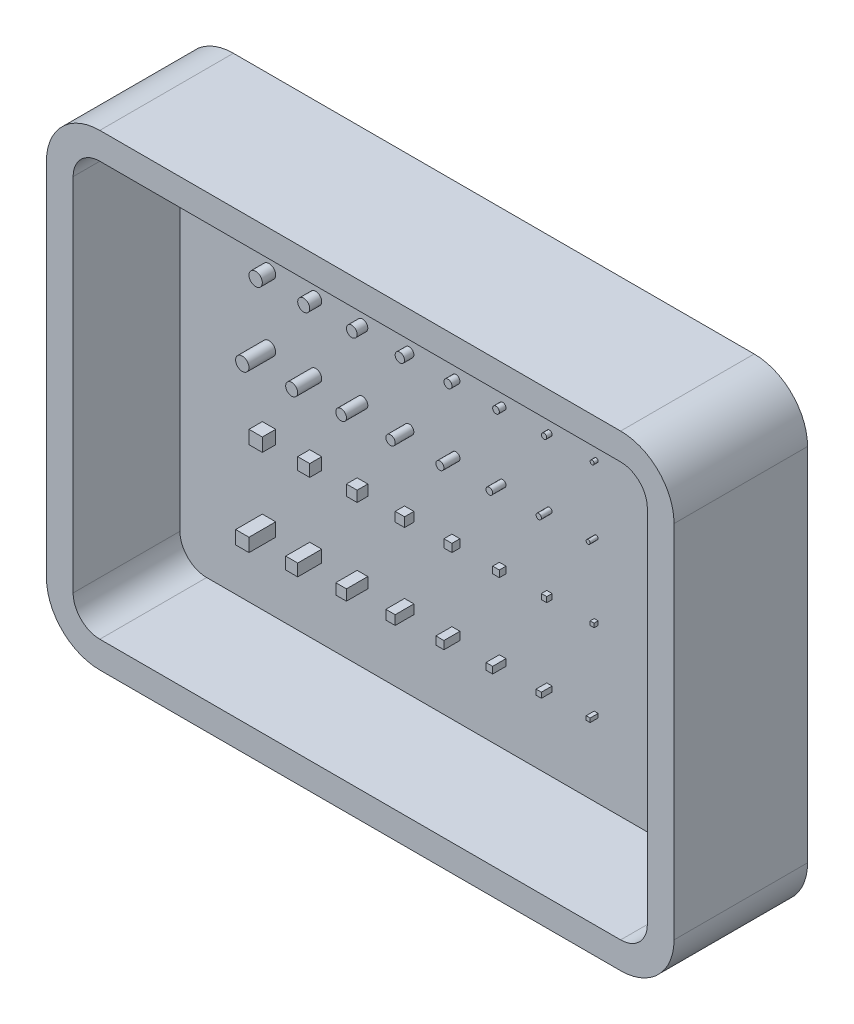
from build123d import *

# Parameters (mm, degrees)
SKETCH1_W            = 47
SKETCH1_H            = 35
BOSS_EXTRUDE1_DEPTH  = 10
FILLET1_R            = 4
SHELL1_T             = -2
SKETCH2_R            = 0.5
BOSS_EXTRUDE6_DEPTH  = 1
SKETCH3_R            = 0.45
BOSS_EXTRUDE7_DEPTH  = 0.9
SKETCH4_R            = 0.4
BOSS_EXTRUDE8_DEPTH  = 0.8
SKETCH5_R            = 0.35
BOSS_EXTRUDE9_DEPTH  = 0.7
SKETCH6_R            = 0.3
BOSS_EXTRUDE10_DEPTH = 0.6
SKETCH7_R            = 0.25
BOSS_EXTRUDE11_DEPTH = 0.5
SKETCH8_R            = 0.2
BOSS_EXTRUDE12_DEPTH = 0.4
SKETCH9_R            = 0.15
BOSS_EXTRUDE13_DEPTH = 0.3
SKETCH10_R           = 0.5
BOSS_EXTRUDE14_DEPTH = 2
SKETCH11_R           = 0.45
BOSS_EXTRUDE15_DEPTH = 1.8
SKETCH12_R           = 0.4
BOSS_EXTRUDE16_DEPTH = 1.6
SKETCH13_R           = 0.35
BOSS_EXTRUDE17_DEPTH = 1.4
SKETCH14_R           = 0.3
BOSS_EXTRUDE18_DEPTH = 1.2
SKETCH15_R           = 0.25
BOSS_EXTRUDE19_DEPTH = 1
SKETCH16_R           = 0.2
BOSS_EXTRUDE20_DEPTH = 0.8
SKETCH17_R           = 0.15
BOSS_EXTRUDE21_DEPTH = 0.6
SKETCH18_W           = 1
SKETCH18_H           = 1
BOSS_EXTRUDE22_DEPTH = 1
SKETCH20_W           = 0.9
SKETCH20_H           = 0.9
BOSS_EXTRUDE23_DEPTH = 0.9
SKETCH21_W           = 0.8
SKETCH21_H           = 0.8
BOSS_EXTRUDE24_DEPTH = 0.8
SKETCH22_W           = 0.7
SKETCH22_H           = 0.7
BOSS_EXTRUDE25_DEPTH = 0.7
SKETCH23_W           = 0.6
SKETCH23_H           = 0.6
BOSS_EXTRUDE26_DEPTH = 0.6
SKETCH24_W           = 0.5
SKETCH24_H           = 0.5
BOSS_EXTRUDE27_DEPTH = 0.5
SKETCH25_W           = 0.4
SKETCH25_H           = 0.4
BOSS_EXTRUDE28_DEPTH = 0.4
SKETCH26_W           = 0.3
SKETCH26_H           = 0.3
BOSS_EXTRUDE29_DEPTH = 0.3
SKETCH27_W           = 1
SKETCH27_H           = 1
BOSS_EXTRUDE30_DEPTH = 2
SKETCH28_W           = 0.9
SKETCH28_H           = 0.9
BOSS_EXTRUDE31_DEPTH = 1.8
SKETCH29_W           = 0.8
SKETCH29_H           = 0.8
BOSS_EXTRUDE32_DEPTH = 1.6
SKETCH30_W           = 0.7
SKETCH30_H           = 0.7
BOSS_EXTRUDE33_DEPTH = 1.4
SKETCH31_W           = 0.6
SKETCH31_H           = 0.6
BOSS_EXTRUDE34_DEPTH = 1.2
SKETCH32_W           = 0.5
SKETCH32_H           = 0.5
BOSS_EXTRUDE35_DEPTH = 1
SKETCH33_W           = 0.4
SKETCH33_H           = 0.4
BOSS_EXTRUDE36_DEPTH = 0.8
SKETCH34_W           = 0.3
SKETCH34_H           = 0.3
BOSS_EXTRUDE37_DEPTH = 0.6


with BuildPart() as part:
    # Sketch1 → Boss-Extrude1 (new body)
    with BuildSketch(Plane.XY):
        with Locations((2.008287293, -0.759668508)):
            Rectangle(SKETCH1_W, SKETCH1_H)
    extrude(amount=BOSS_EXTRUDE1_DEPTH)

    # Fillet1
    fillet1_edges = [part.edges().sort_by_distance(p)[0] for p in [
        (25.508287293, 16.740331492, 5),
        (25.508287293, -18.259668508, 5),
        (-21.491712707, -18.259668508, 5),
        (-21.491712707, 16.740331492, 5),
    ]]
    fillet(fillet1_edges, radius=FILLET1_R)

    # Shell1
    shell1_openings = [part.faces().sort_by_distance(p)[0] for p in [
        (2.008287293, -0.759668508, 10),
    ]]
    offset(amount=SHELL1_T, openings=shell1_openings, kind=Kind.INTERSECTION)

    # Sketch2 → Boss-Extrude6 (add)
    with BuildSketch(Plane.XY.offset(2)):
        with Locations((-12.824656071, 5.939639856)):
            Circle(SKETCH2_R)
    extrude(amount=BOSS_EXTRUDE6_DEPTH)

    # Sketch3 → Boss-Extrude7 (add)
    with BuildSketch(Plane.XY.offset(2)):
        with Locations((-9.324656071, 5.939639856)):
            Circle(SKETCH3_R)
    extrude(amount=BOSS_EXTRUDE7_DEPTH)

    # Sketch4 → Boss-Extrude8 (add)
    with BuildSketch(Plane.XY.offset(2)):
        with Locations((-5.824656071, 5.939639856)):
            Circle(SKETCH4_R)
    extrude(amount=BOSS_EXTRUDE8_DEPTH)

    # Sketch5 → Boss-Extrude9 (add)
    with BuildSketch(Plane.XY.offset(2)):
        with Locations((-2.324656071, 5.939639856)):
            Circle(SKETCH5_R)
    extrude(amount=BOSS_EXTRUDE9_DEPTH)

    # Sketch6 → Boss-Extrude10 (add)
    with BuildSketch(Plane.XY.offset(2)):
        with Locations((1.175343929, 5.939639856)):
            Circle(SKETCH6_R)
    extrude(amount=BOSS_EXTRUDE10_DEPTH)

    # Sketch7 → Boss-Extrude11 (add)
    with BuildSketch(Plane.XY.offset(2)):
        with Locations((4.675343929, 5.939639856)):
            Circle(SKETCH7_R)
    extrude(amount=BOSS_EXTRUDE11_DEPTH)

    # Sketch8 → Boss-Extrude12 (add)
    with BuildSketch(Plane.XY.offset(2)):
        with Locations((8.175343929, 5.939639856)):
            Circle(SKETCH8_R)
    extrude(amount=BOSS_EXTRUDE12_DEPTH)

    # Sketch9 → Boss-Extrude13 (add)
    with BuildSketch(Plane.XY.offset(2)):
        with Locations((11.675343929, 5.939639856)):
            Circle(SKETCH9_R)
    extrude(amount=BOSS_EXTRUDE13_DEPTH)

    # Sketch10 → Boss-Extrude14 (add)
    with BuildSketch(Plane.XY.offset(2)):
        with Locations((-12.824656071, 0.939639856)):
            Circle(SKETCH10_R)
    extrude(amount=BOSS_EXTRUDE14_DEPTH)

    # Sketch11 → Boss-Extrude15 (add)
    with BuildSketch(Plane.XY.offset(2)):
        with Locations((-9.324656071, 0.931713012)):
            Circle(SKETCH11_R)
    extrude(amount=BOSS_EXTRUDE15_DEPTH)

    # Sketch12 → Boss-Extrude16 (add)
    with BuildSketch(Plane.XY.offset(2)):
        with Locations((-5.824656071, 0.931713012)):
            Circle(SKETCH12_R)
    extrude(amount=BOSS_EXTRUDE16_DEPTH)

    # Sketch13 → Boss-Extrude17 (add)
    with BuildSketch(Plane.XY.offset(2)):
        with Locations((-2.324656071, 0.931713012)):
            Circle(SKETCH13_R)
    extrude(amount=BOSS_EXTRUDE17_DEPTH)

    # Sketch14 → Boss-Extrude18 (add)
    with BuildSketch(Plane.XY.offset(2)):
        with Locations((1.175343929, 0.931713012)):
            Circle(SKETCH14_R)
    extrude(amount=BOSS_EXTRUDE18_DEPTH)

    # Sketch15 → Boss-Extrude19 (add)
    with BuildSketch(Plane.XY.offset(2)):
        with Locations((4.675343929, 0.931713012)):
            Circle(SKETCH15_R)
    extrude(amount=BOSS_EXTRUDE19_DEPTH)

    # Sketch16 → Boss-Extrude20 (add)
    with BuildSketch(Plane.XY.offset(2)):
        with Locations((8.175343929, 0.931713012)):
            Circle(SKETCH16_R)
    extrude(amount=BOSS_EXTRUDE20_DEPTH)

    # Sketch17 → Boss-Extrude21 (add)
    with BuildSketch(Plane.XY.offset(2)):
        with Locations((11.675343929, 0.931713012)):
            Circle(SKETCH17_R)
    extrude(amount=BOSS_EXTRUDE21_DEPTH)

    # Sketch18 → Boss-Extrude22 (add)
    with BuildSketch(Plane.XY.offset(2)):
        with Locations((-12.821712707, -4.560360144)):
            Rectangle(SKETCH18_W, SKETCH18_H)
    extrude(amount=BOSS_EXTRUDE22_DEPTH)

    # Sketch20 → Boss-Extrude23 (add)
    with BuildSketch(Plane.XY.offset(2)):
        with Locations((-9.324656071, -4.560360144)):
            Rectangle(SKETCH20_W, SKETCH20_H)
    extrude(amount=BOSS_EXTRUDE23_DEPTH)

    # Sketch21 → Boss-Extrude24 (add)
    with BuildSketch(Plane.XY.offset(2)):
        with Locations((-5.824656071, -4.560360144)):
            Rectangle(SKETCH21_W, SKETCH21_H)
    extrude(amount=BOSS_EXTRUDE24_DEPTH)

    # Sketch22 → Boss-Extrude25 (add)
    with BuildSketch(Plane.XY.offset(2)):
        with Locations((-2.324656071, -4.560360144)):
            Rectangle(SKETCH22_W, SKETCH22_H)
    extrude(amount=BOSS_EXTRUDE25_DEPTH)

    # Sketch23 → Boss-Extrude26 (add)
    with BuildSketch(Plane.XY.offset(2)):
        with Locations((1.175343929, -4.560360144)):
            Rectangle(SKETCH23_W, SKETCH23_H)
    extrude(amount=BOSS_EXTRUDE26_DEPTH)

    # Sketch24 → Boss-Extrude27 (add)
    with BuildSketch(Plane.XY.offset(2)):
        with Locations((4.675343929, -4.560360144)):
            Rectangle(SKETCH24_W, SKETCH24_H)
    extrude(amount=BOSS_EXTRUDE27_DEPTH)

    # Sketch25 → Boss-Extrude28 (add)
    with BuildSketch(Plane.XY.offset(2)):
        with Locations((8.175343929, -4.560360144)):
            Rectangle(SKETCH25_W, SKETCH25_H)
    extrude(amount=BOSS_EXTRUDE28_DEPTH)

    # Sketch26 → Boss-Extrude29 (add)
    with BuildSketch(Plane.XY.offset(2)):
        with Locations((11.675343929, -4.560360144)):
            Rectangle(SKETCH26_W, SKETCH26_H)
    extrude(amount=BOSS_EXTRUDE29_DEPTH)

    # Sketch27 → Boss-Extrude30 (add)
    with BuildSketch(Plane.XY.offset(2)):
        with Locations((-12.821712707, -10.560360144)):
            Rectangle(SKETCH27_W, SKETCH27_H)
    extrude(amount=BOSS_EXTRUDE30_DEPTH)

    # Sketch28 → Boss-Extrude31 (add)
    with BuildSketch(Plane.XY.offset(2)):
        with Locations((-9.324656071, -10.560360144)):
            Rectangle(SKETCH28_W, SKETCH28_H)
    extrude(amount=BOSS_EXTRUDE31_DEPTH)

    # Sketch29 → Boss-Extrude32 (add)
    with BuildSketch(Plane.XY.offset(2)):
        with Locations((-5.824656071, -10.560360144)):
            Rectangle(SKETCH29_W, SKETCH29_H)
    extrude(amount=BOSS_EXTRUDE32_DEPTH)

    # Sketch30 → Boss-Extrude33 (add)
    with BuildSketch(Plane.XY.offset(2)):
        with Locations((-2.324656071, -10.560360144)):
            Rectangle(SKETCH30_W, SKETCH30_H)
    extrude(amount=BOSS_EXTRUDE33_DEPTH)

    # Sketch31 → Boss-Extrude34 (add)
    with BuildSketch(Plane.XY.offset(2)):
        with Locations((1.175343929, -10.560360144)):
            Rectangle(SKETCH31_W, SKETCH31_H)
    extrude(amount=BOSS_EXTRUDE34_DEPTH)

    # Sketch32 → Boss-Extrude35 (add)
    with BuildSketch(Plane.XY.offset(2)):
        with Locations((4.675343929, -10.560360144)):
            Rectangle(SKETCH32_W, SKETCH32_H)
    extrude(amount=BOSS_EXTRUDE35_DEPTH)

    # Sketch33 → Boss-Extrude36 (add)
    with BuildSketch(Plane.XY.offset(2)):
        with Locations((8.175343929, -10.560360144)):
            Rectangle(SKETCH33_W, SKETCH33_H)
    extrude(amount=BOSS_EXTRUDE36_DEPTH)

    # Sketch34 → Boss-Extrude37 (add)
    with BuildSketch(Plane.XY.offset(2)):
        with Locations((11.675343929, -10.560360144)):
            Rectangle(SKETCH34_W, SKETCH34_H)
    extrude(amount=BOSS_EXTRUDE37_DEPTH)


solid = part.part
